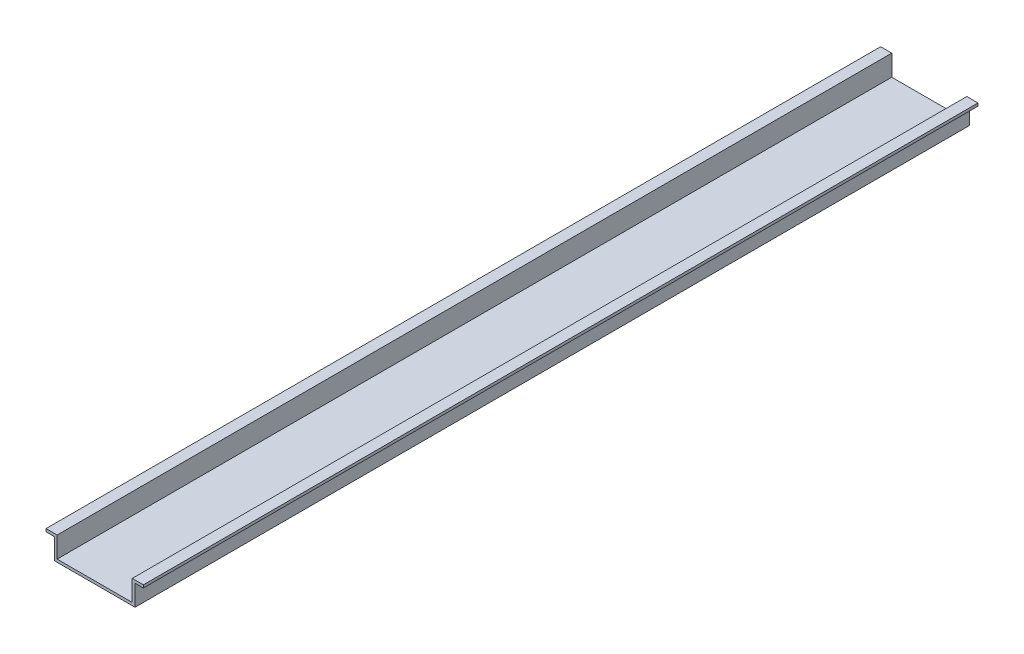
from build123d import *

# Parameters (mm, degrees)
EXTRUDE_THIN1_DEPTH = 150


with BuildPart() as part:
    # Sketch1 → Extrude-Thin1 (new, symmetric)
    with BuildSketch(Plane.XY):
        Polygon((17.5, 7.5), (13.5, 7.5), (13.5, 0), (-13.5, 0), (-13.5, 7.5), (-17.5, 7.5), (-17.5, 6.5), (-14.5, 6.5), (-14.5, -1), (14.5, -1), (14.5, 6.5), (17.5, 6.5), align=None)
    extrude(amount=EXTRUDE_THIN1_DEPTH, both=True)


solid = part.part
